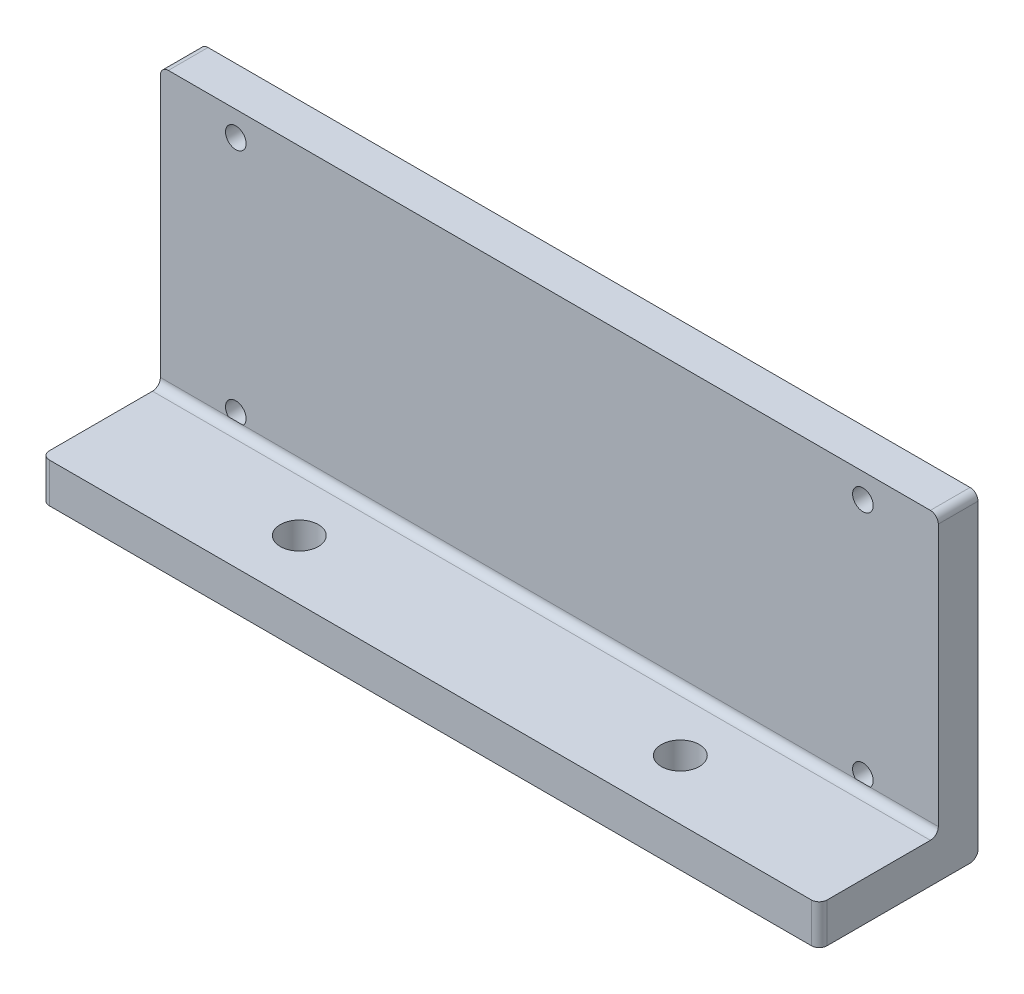
from build123d import *

# Parameters (mm, degrees)
SKETCH1_W                     = 98
SKETCH1_H                     = 20
BOSS_EXTRUDE1_DEPTH           = 5
SKETCH2_W                     = 98
SKETCH2_H                     = 5
BOSS_EXTRUDE2_DEPTH           = 35
FILLET1_R                     = 1
SKETCH5_W                     = 1.3
SKETCH5_H                     = 5
M2_CLEARANCE_HOLE1_AT_2_COUNT = 2
M2_CLEARANCE_HOLE1_AT_2_PITCH = 30
M2_CLEARANCE_HOLE1_AT_3_COUNT = 2
M2_CLEARANCE_HOLE1_AT_3_PITCH = 79
M2_CLEARANCE_HOLE1_AT_4_COUNT = 2
M2_CLEARANCE_HOLE1_AT_4_PITCH = 84.504437753
M4_CLEARANCE_HOLE1_D          = 4.8


with BuildPart() as part:
    # Sketch1 → Boss-Extrude1 (new body)
    with BuildSketch(Plane(origin=(0, 0, 0), x_dir=(1, 0, 0), z_dir=(0, 1, 0))):
        Rectangle(SKETCH1_W, SKETCH1_H)
    extrude(amount=BOSS_EXTRUDE1_DEPTH)

    # Sketch2 → Boss-Extrude2 (add)
    with BuildSketch(Plane(origin=(0, 5, 0), x_dir=(1, 0, 0), z_dir=(0, 1, 0))):
        with Locations((0, 7.5)):
            Rectangle(SKETCH2_W, SKETCH2_H)
    extrude(amount=BOSS_EXTRUDE2_DEPTH)

    # Fillet1
    fillet1_edges = [part.edges().sort_by_distance(p)[0] for p in [
        (0, 5, -5),
        (49, 40, -7.5),
        (-49, 40, -7.5),
        (0, 0, -10),
        (49, 2.5, 10),
        (-49, 2.5, 10),
    ]]
    fillet(fillet1_edges, radius=FILLET1_R)

    # Sketch5 → M2 Clearance Hole1 (revolve, cut)
    with BuildSketch(Plane(origin=(39.5, 36.904051391, -5), x_dir=(0, -1, 0), z_dir=(1, 0, 0))):
        with Locations((0.65, 2.5)):
            Rectangle(SKETCH5_W, SKETCH5_H)
    m2_clearance_hole1 = revolve(axis=Axis((39.5, 36.904051391, 1.35), (0, 0, -1)), mode=Mode.SUBTRACT)

    # M2 Clearance Hole1 at 2: M2 Clearance Hole1 ×2
    with Locations(*[(0, -i * M2_CLEARANCE_HOLE1_AT_2_PITCH, 0) for i in range(1, M2_CLEARANCE_HOLE1_AT_2_COUNT)]):
        add(m2_clearance_hole1, mode=Mode.SUBTRACT)

    # M2 Clearance Hole1 at 3: M2 Clearance Hole1 ×2
    with Locations(*[(-i * M2_CLEARANCE_HOLE1_AT_3_PITCH, 0, 0) for i in range(1, M2_CLEARANCE_HOLE1_AT_3_COUNT)]):
        add(m2_clearance_hole1, mode=Mode.SUBTRACT)

    # M2 Clearance Hole1 at 4: M2 Clearance Hole1 ×2
    with Locations(*[Vector(-0.93486214570929, -0.35501094140860234, 0) * (i * M2_CLEARANCE_HOLE1_AT_4_PITCH) for i in range(1, M2_CLEARANCE_HOLE1_AT_4_COUNT)]):
        add(m2_clearance_hole1, mode=Mode.SUBTRACT)

    # M4 Clearance Hole1 (through all)
    with Locations(Plane(origin=(-24, 5, 2.5), x_dir=(0, 0, 1), z_dir=(0, 1, 0))):
        with Locations((0, 0), (0, 48)):
            Hole(M4_CLEARANCE_HOLE1_D / 2)


solid = part.part
